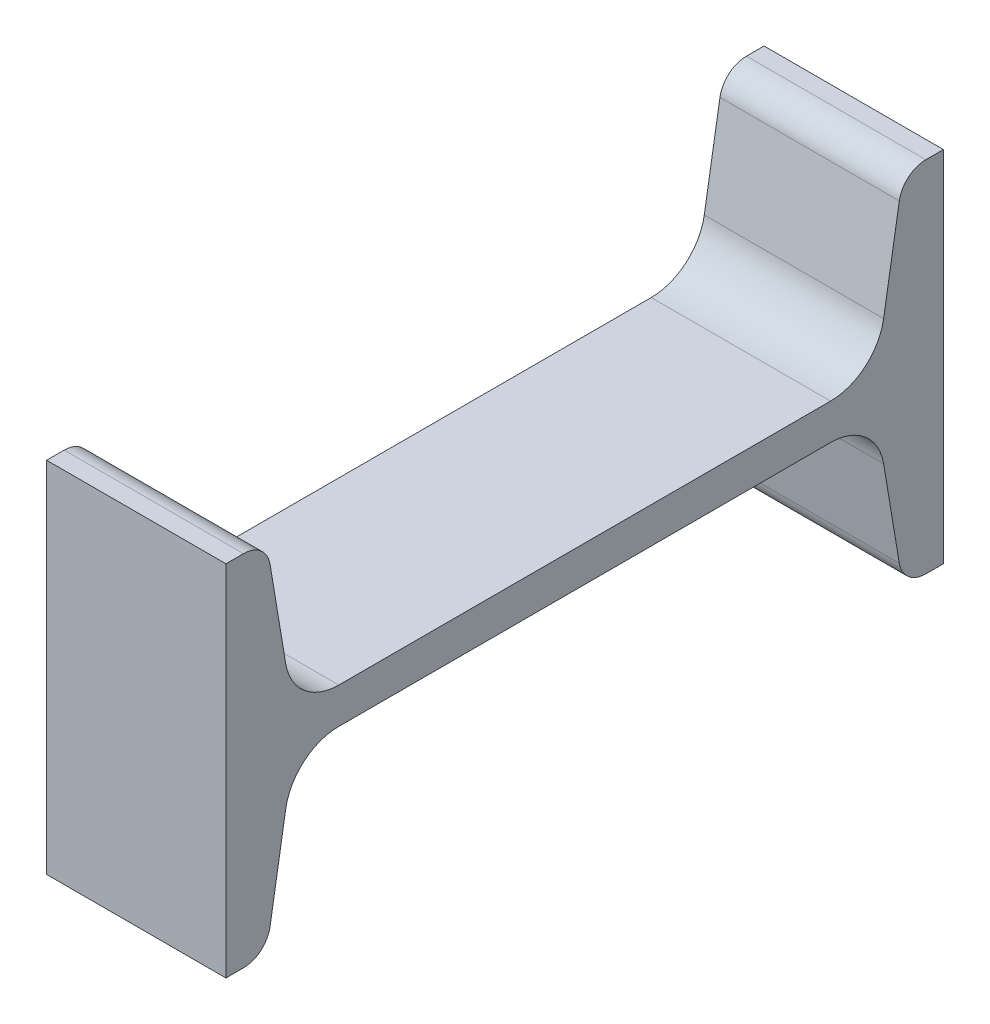
from build123d import *

# Parameters (mm, degrees)
SB_KIRI_80_X_6_1_DEPTH = 20


with BuildPart() as part:
    # Sketch1 → Sb kiriş 80 X 6(1) (new body)
    with BuildSketch(Plane.YZ):
        with BuildLine():
            Line((-20, -40), (-20, -38.04146021))
            ThreePointArc((-20, -38.04146021), (-19.289071417, -36.102349061), (-17.493231968, -35.082284273))
            Line((-17.493231968, -35.082284273), (-7.013536064, -33.335540874))
            ThreePointArc((-7.013536064, -33.335540874), (-3.421857166, -31.295411298), (-2, -27.417189))
            Line((-2, -27.417189), (-2, 27.417189))
            ThreePointArc((-2, 27.417189), (-3.421857166, 31.295411298), (-7.013536064, 33.335540874))
            Line((-7.013536064, 33.335540874), (-17.493231968, 35.082284273))
            ThreePointArc((-17.493231968, 35.082284273), (-19.289071417, 36.102349061), (-20, 38.04146021))
            Line((-20, 38.04146021), (-20, 40))
            Line((-20, 40), (20, 40))
            Line((20, 40), (20, 38.04146021))
            ThreePointArc((20, 38.04146021), (19.289071417, 36.102349061), (17.493231968, 35.082284273))
            Line((17.493231968, 35.082284273), (7.013536064, 33.335540874))
            ThreePointArc((7.013536064, 33.335540874), (3.421857166, 31.295411298), (2, 27.417189))
            Line((2, 27.417189), (2, -27.417189))
            ThreePointArc((2, -27.417189), (3.421857166, -31.295411298), (7.013536064, -33.335540874))
            Line((7.013536064, -33.335540874), (17.493231968, -35.082284273))
            ThreePointArc((17.493231968, -35.082284273), (19.289071417, -36.102349061), (20, -38.04146021))
            Line((20, -38.04146021), (20, -40))
            Line((20, -40), (-20, -40))
        make_face()
    extrude(amount=SB_KIRI_80_X_6_1_DEPTH)


solid = part.part
